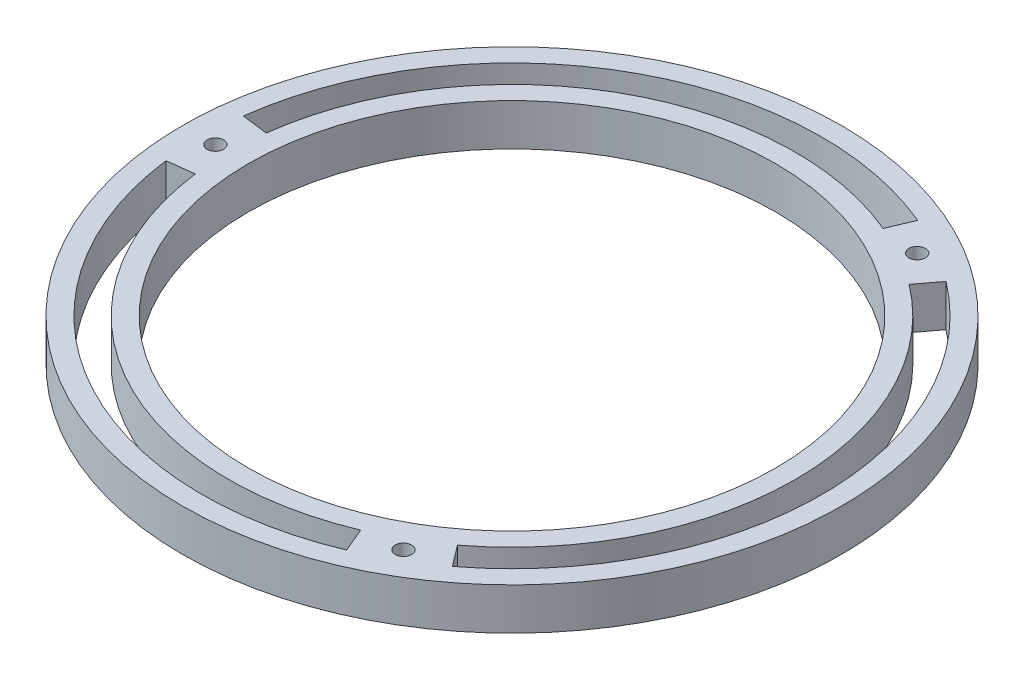
from build123d import *

# Parameters (mm, degrees)
BOSS_EXTRUDE1_DEPTH = 6.35
M3_TAP_HOLES_REACH  = 72.995
SKETCH2_R           = 1.25


with BuildPart() as part:
    # Sketch1 → Boss-Extrude1 (new body)
    with BuildSketch(Plane(origin=(0, 0, 0), x_dir=(1, 0, 0), z_dir=(0, 1, 0))):
        with BuildLine():
            ThreePointArc((50, 0), (44.781853835, 22.239279825), (30.216577315, 39.83664714))
            Line((30.216577315, 39.83664714), (28.403582676, 37.446448312))
            ThreePointArc((28.403582676, 37.446448312), (42.094942605, 20.904923035), (47, 0))
            ThreePointArc((47, 0), (42.094942605, -20.904923035), (28.403582676, -37.446448312))
            Line((28.403582676, -37.446448312), (30.216577315, -39.83664714))
            ThreePointArc((30.216577315, -39.83664714), (44.781853835, -22.239279825), (50, 0))
        make_face()
        with BuildLine():
            ThreePointArc((43, 0), (38.512394298, 19.125780649), (25.986256491, 34.259516541))
            Line((25.986256491, 34.259516541), (24.173261852, 31.869317712))
            ThreePointArc((24.173261852, 31.869317712), (35.825483068, 17.79142386), (40, 0))
            ThreePointArc((40, 0), (35.825483068, -17.79142386), (24.173261852, -31.869317712))
            Line((24.173261852, -31.869317712), (25.986256491, -34.259516541))
            ThreePointArc((25.986256491, -34.259516541), (38.512394298, -19.125780649), (43, 0))
        make_face()
        with BuildLine():
            ThreePointArc((16.6764834, -39.634516541), (21.5, -37.239092363), (25.986256491, -34.259516541))
            Line((25.986256491, -34.259516541), (24.173261852, -31.869317712))
            ThreePointArc((24.173261852, -31.869317712), (20, -34.641016151), (15.513007814, -36.869317712))
            Line((15.513007814, -36.869317712), (16.6764834, -39.634516541))
        make_face()
        with BuildLine():
            ThreePointArc((18.227784182, -43.321448312), (23.5, -40.703193978), (28.403582676, -37.446448312))
            Line((28.403582676, -37.446448312), (25.986256491, -34.259516541))
            ThreePointArc((25.986256491, -34.259516541), (21.5, -37.239092363), (16.6764834, -39.634516541))
            Line((16.6764834, -39.634516541), (18.227784182, -43.321448312))
        make_face()
        with BuildLine():
            ThreePointArc((19.391259768, -46.08664714), (25, -43.301270189), (30.216577315, -39.83664714))
            Line((30.216577315, -39.83664714), (28.403582676, -37.446448312))
            ThreePointArc((28.403582676, -37.446448312), (23.5, -40.703193978), (18.227784182, -43.321448312))
            Line((18.227784182, -43.321448312), (19.391259768, -46.08664714))
        make_face()
        with BuildLine():
            ThreePointArc((-49.607837082, -6.25), (-25, -43.301270189), (19.391259768, -46.08664714))
            Line((19.391259768, -46.08664714), (18.227784182, -43.321448312))
            ThreePointArc((18.227784182, -43.321448312), (-23.5, -40.703193978), (-46.631366858, -5.875))
            Line((-46.631366858, -5.875), (-49.607837082, -6.25))
        make_face()
        with BuildLine():
            ThreePointArc((-42.662739891, -5.375), (-21.5, -37.239092363), (16.6764834, -39.634516541))
            Line((16.6764834, -39.634516541), (15.513007814, -36.869317712))
            ThreePointArc((15.513007814, -36.869317712), (-20, -34.641016151), (-39.686269666, -5))
            Line((-39.686269666, -5), (-42.662739891, -5.375))
        make_face()
        with BuildLine():
            Line((-39.686269666, 5), (-42.662739891, 5.375))
            ThreePointArc((-42.662739891, 5.375), (-43, 0), (-42.662739891, -5.375))
            Line((-42.662739891, -5.375), (-39.686269666, -5))
            ThreePointArc((-39.686269666, -5), (-40, 0), (-39.686269666, 5))
        make_face()
        with BuildLine():
            Line((-42.662739891, 5.375), (-46.631366858, 5.875))
            ThreePointArc((-46.631366858, 5.875), (-47, 0), (-46.631366858, -5.875))
            Line((-46.631366858, -5.875), (-42.662739891, -5.375))
            ThreePointArc((-42.662739891, -5.375), (-43, 0), (-42.662739891, 5.375))
        make_face()
        with BuildLine():
            Line((-46.631366858, 5.875), (-49.607837082, 6.25))
            ThreePointArc((-49.607837082, 6.25), (-50, 0), (-49.607837082, -6.25))
            Line((-49.607837082, -6.25), (-46.631366858, -5.875))
            ThreePointArc((-46.631366858, -5.875), (-47, 0), (-46.631366858, 5.875))
        make_face()
        with BuildLine():
            Line((18.227784182, 43.321448312), (19.391259768, 46.08664714))
            ThreePointArc((19.391259768, 46.08664714), (-25, 43.301270189), (-49.607837082, 6.25))
            Line((-49.607837082, 6.25), (-46.631366858, 5.875))
            ThreePointArc((-46.631366858, 5.875), (-23.5, 40.703193978), (18.227784182, 43.321448312))
        make_face()
        with BuildLine():
            Line((15.513007814, 36.869317712), (16.6764834, 39.634516541))
            ThreePointArc((16.6764834, 39.634516541), (-21.5, 37.239092363), (-42.662739891, 5.375))
            Line((-42.662739891, 5.375), (-39.686269666, 5))
            ThreePointArc((-39.686269666, 5), (-20, 34.641016151), (15.513007814, 36.869317712))
        make_face()
        with BuildLine():
            Line((24.173261852, 31.869317712), (25.986256491, 34.259516541))
            ThreePointArc((25.986256491, 34.259516541), (21.5, 37.239092363), (16.6764834, 39.634516541))
            Line((16.6764834, 39.634516541), (15.513007814, 36.869317712))
            ThreePointArc((15.513007814, 36.869317712), (20, 34.641016151), (24.173261852, 31.869317712))
        make_face()
        with BuildLine():
            Line((25.986256491, 34.259516541), (28.403582676, 37.446448312))
            ThreePointArc((28.403582676, 37.446448312), (23.5, 40.703193978), (18.227784182, 43.321448312))
            Line((18.227784182, 43.321448312), (16.6764834, 39.634516541))
            ThreePointArc((16.6764834, 39.634516541), (21.5, 37.239092363), (25.986256491, 34.259516541))
        make_face()
        with BuildLine():
            Line((28.403582676, 37.446448312), (30.216577315, 39.83664714))
            ThreePointArc((30.216577315, 39.83664714), (25, 43.301270189), (19.391259768, 46.08664714))
            Line((19.391259768, 46.08664714), (18.227784182, 43.321448312))
            ThreePointArc((18.227784182, 43.321448312), (23.5, 40.703193978), (28.403582676, 37.446448312))
        make_face()
    extrude(amount=BOSS_EXTRUDE1_DEPTH)

    # Sketch2 → M3-tap-holes (cut, up to next)
    with BuildSketch(Plane(origin=(0, 6.35, 0), x_dir=(1, 0, 0), z_dir=(0, 1, 0)), mode=Mode.PRIVATE) as m3_tap_holes_sk1:
        with Locations(Location((-45, 0, 0), (0, 0, 270))):
            Circle(SKETCH2_R)
    m3_tap_holes_tool1 = extrude(m3_tap_holes_sk1.sketch, amount=-M3_TAP_HOLES_REACH, mode=Mode.PRIVATE) & part.part
    # Sketch2 → M3-tap-holes (cut, up to next)
    with BuildSketch(Plane(origin=(0, 6.35, 0), x_dir=(1, 0, 0), z_dir=(0, 1, 0)), mode=Mode.PRIVATE) as m3_tap_holes_sk2:
        with Locations(Location((22.5, -38.97114317, 0), (0, 0, 270))):
            Circle(SKETCH2_R)
    m3_tap_holes_tool2 = extrude(m3_tap_holes_sk2.sketch, amount=-M3_TAP_HOLES_REACH, mode=Mode.PRIVATE) & part.part
    # Sketch2 → M3-tap-holes (cut, up to next)
    with BuildSketch(Plane(origin=(0, 6.35, 0), x_dir=(1, 0, 0), z_dir=(0, 1, 0)), mode=Mode.PRIVATE) as m3_tap_holes_sk3:
        with Locations(Location((22.5, 38.97114317, 0), (0, 0, 270))):
            Circle(SKETCH2_R)
    m3_tap_holes_tool3 = extrude(m3_tap_holes_sk3.sketch, amount=-M3_TAP_HOLES_REACH, mode=Mode.PRIVATE) & part.part
    add(m3_tap_holes_tool1.solids().sort_by_distance((-45, 6.35, 0))[0], mode=Mode.SUBTRACT)
    add(m3_tap_holes_tool2.solids().sort_by_distance((22.5, 6.35, 38.971143))[0], mode=Mode.SUBTRACT)
    add(m3_tap_holes_tool3.solids().sort_by_distance((22.5, 6.35, -38.971143))[0], mode=Mode.SUBTRACT)


solid = part.part
